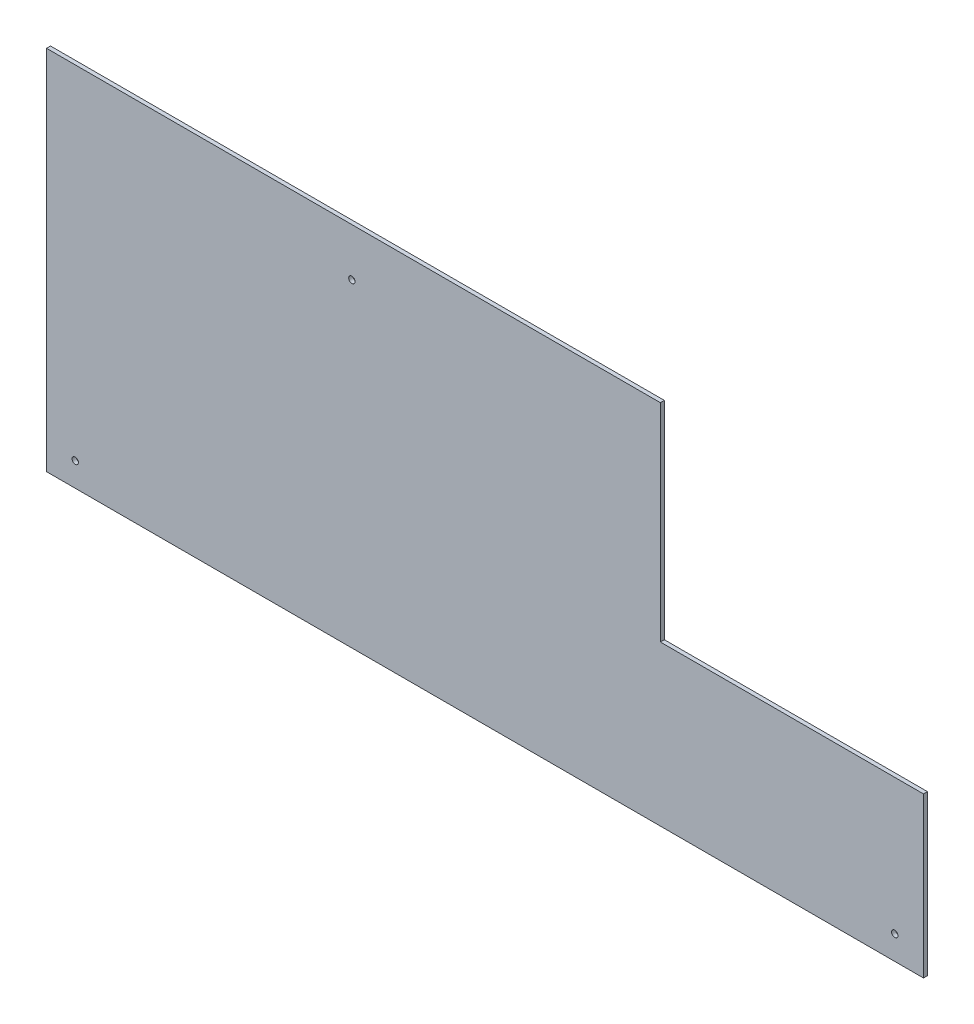
from build123d import *

# Parameters (mm, degrees)
SCHIZZO1_W                   = 550
SCHIZZO1_H                   = 230
ESTRUSIONE_ESTRUSIONE1_DEPTH = 2.5
SCHIZZO2_W                   = 165
SCHIZZO2_H                   = 130
TAGLIO_ESTRUSIONE1_DEPTH     = 10
SCHIZZO3_R                   = 2
TAGLIO_ESTRUSIONE2_DEPTH     = 10


with BuildPart() as part:
    # Schizzo1 → Estrusione-Estrusione1 (new body)
    with BuildSketch(Plane.XY):
        Rectangle(SCHIZZO1_W, SCHIZZO1_H)
    extrude(amount=ESTRUSIONE_ESTRUSIONE1_DEPTH)

    # Schizzo2 → Taglio-Estrusione1 (cut)
    with BuildSketch(Plane(origin=(0, 0, 0), x_dir=(-1, 0, 0), z_dir=(0, 0, -1))):
        with Locations((-192.5, 50)):
            Rectangle(SCHIZZO2_W, SCHIZZO2_H)
    extrude(amount=-TAGLIO_ESTRUSIONE1_DEPTH, mode=Mode.SUBTRACT)

    # Schizzo3 → Taglio-Estrusione2 (cut)
    with BuildSketch(Plane.XY.offset(2.5)):
        with Locations((-83.5, 85)):
            Circle(SCHIZZO3_R)
        with Locations((-257, -100)):
            Circle(SCHIZZO3_R)
        with Locations((257, -100)):
            Circle(SCHIZZO3_R)
    extrude(amount=-TAGLIO_ESTRUSIONE2_DEPTH, mode=Mode.SUBTRACT)


solid = part.part
